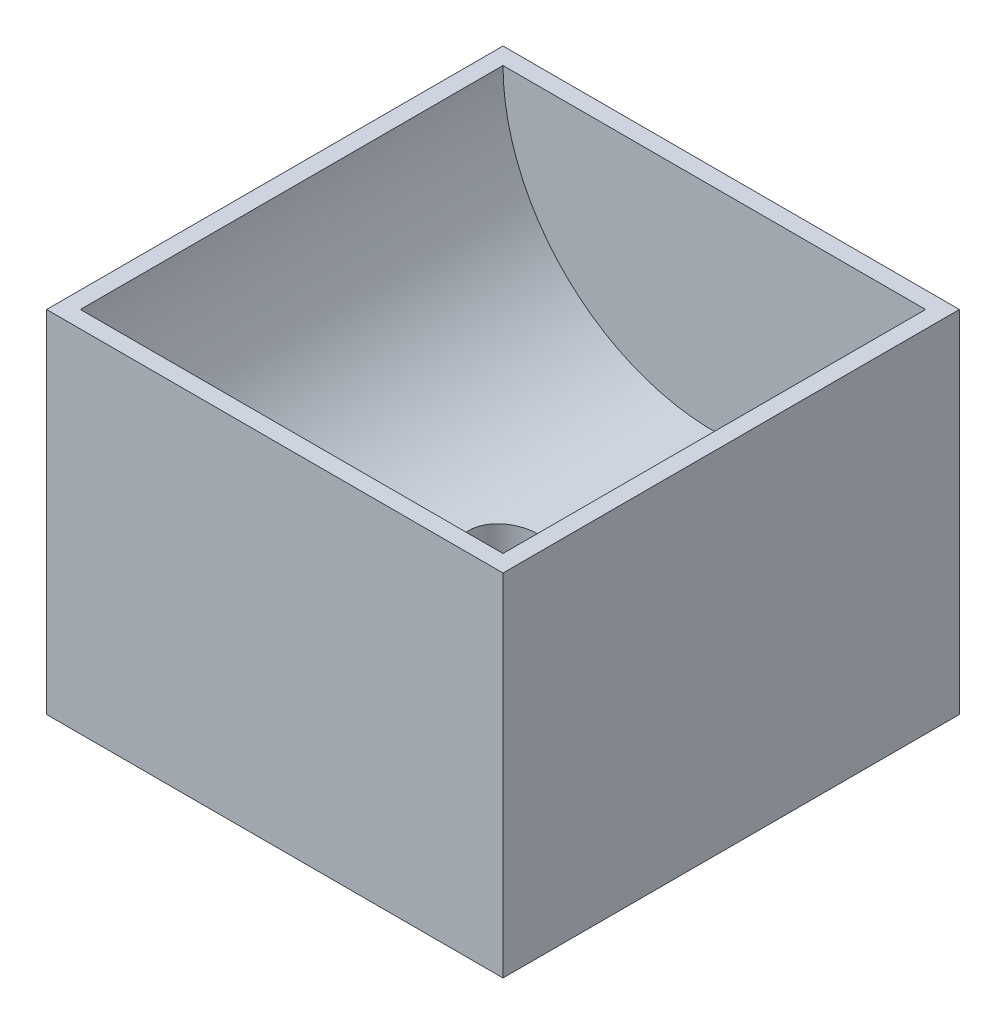
from build123d import *

# Parameters (mm, degrees)
BOSS_EXTRUDE1_DEPTH = 25
SKETCH2_W           = 54
SKETCH2_H           = 28
BOSS_EXTRUDE2_DEPTH = 2
SKETCH3_W           = 54
SKETCH3_H           = 28
BOSS_EXTRUDE3_DEPTH = 2
SKETCH4_R           = 4.05
CUT_EXTRUDE2_DEPTH  = 48.349762407
SKETCH5_W           = 54
SKETCH5_H           = 54
BOSS_EXTRUDE4_DEPTH = 13.5
SKETCH6_R           = 8
CUT_EXTRUDE3_DEPTH  = 7


with BuildPart() as part:
    # Sketch1 → Boss-Extrude1 (new, symmetric)
    with BuildSketch(Plane.XY):
        with BuildLine():
            Line((25, 0), (27, 0))
            Line((27, 0), (27, -28))
            Line((27, -28), (-27, -28))
            Line((-27, -28), (-27, 0))
            Line((-27, 0), (-25, 0))
            ThreePointArc((-25, 0), (0, -25), (25, 0))
        make_face()
    extrude(amount=BOSS_EXTRUDE1_DEPTH, both=True)

    # Sketch2 → Boss-Extrude2 (add)
    with BuildSketch(Plane.XY.offset(25)):
        with Locations((0, -14)):
            Rectangle(SKETCH2_W, SKETCH2_H)
    extrude(amount=BOSS_EXTRUDE2_DEPTH)

    # Sketch3 → Boss-Extrude3 (add)
    with BuildSketch(Plane(origin=(0, 0, -25), x_dir=(-1, 0, 0), z_dir=(0, 0, -1))):
        with Locations((0, -14)):
            Rectangle(SKETCH3_W, SKETCH3_H)
    extrude(amount=BOSS_EXTRUDE3_DEPTH)

    # Sketch4 → Cut-Extrude2 (cut, through all)
    with BuildSketch(Plane.XZ.offset(28)):
        with Locations(Location((0, 0, 0), (0, 0, 270))):
            Circle(SKETCH4_R)
    extrude(amount=-CUT_EXTRUDE2_DEPTH, mode=Mode.SUBTRACT)

    # Sketch5 → Boss-Extrude4 (add)
    with BuildSketch(Plane.XZ.offset(28)):
        Rectangle(SKETCH5_W, SKETCH5_H)
        Polygon((-7.505553499, 0), (-3.75277675, -6.5), (3.75277675, -6.5), (7.505553499, 0), (3.75277675, 6.5), (-3.75277675, 6.5), align=None, mode=Mode.SUBTRACT)
    extrude(amount=BOSS_EXTRUDE4_DEPTH)

    # Sketch6 → Cut-Extrude3 (cut)
    with BuildSketch(Plane.XZ.offset(41.5)):
        with Locations(Location((0, 0, 0), (0, 0, 270))):
            Circle(SKETCH6_R)
    extrude(amount=-CUT_EXTRUDE3_DEPTH, mode=Mode.SUBTRACT)


solid = part.part
